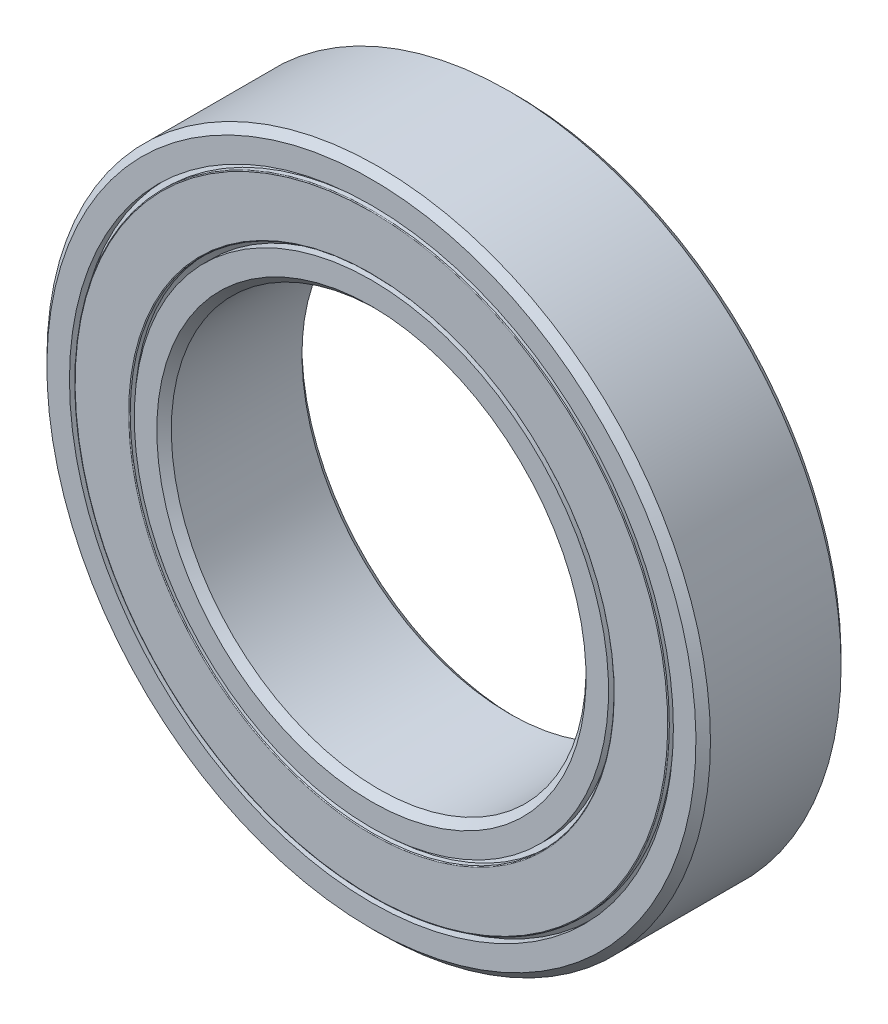
from build123d import *

# Parameters (mm, degrees)
CIRPATTERN1_COUNT   = 13
SKETCH7_R           = 13.78125
SKETCH7_R_2         = 13
BOSS_EXTRUDE1_DEPTH = 0.583333333
FILLET1_R           = 0.038888889
FILLET2_R           = 0.038888889


with BuildPart() as part:
    # Sketch3 → Revolve1 (revolve)
    with BuildSketch(Plane(origin=(0, 0, 0), x_dir=(0, 0, -1), z_dir=(1, 0, 0)), mode=Mode.PRIVATE) as revolve1_sk:
        with BuildLine():
            Line((3.15, 16), (3.5, 15.65))
            Line((3.5, 15.65), (3.5, 14.5625))
            Line((3.5, 14.5625), (1.555555556, 14.5625))
            ThreePointArc((1.555555556, 14.5625), (0, 15.204803696), (-1.555555556, 14.5625))
            Line((-1.555555556, 14.5625), (-3.5, 14.5625))
            Line((-3.5, 14.5625), (-3.5, 15.65))
            Line((-3.5, 15.65), (-3.15, 16))
            Line((-3.15, 16), (3.15, 16))
        make_face()
    revolve(revolve1_sk.sketch.rotate(Axis((0, 0, 3.5), (0, 0, -1)), 180), axis=Axis((0, 0, 3.5), (0, 0, -1)))


with BuildPart() as body_2:
    # Sketch4 → Revolve2 (revolve)
    with BuildSketch(Plane(origin=(0, 0, 0), x_dir=(0, 0, -1), z_dir=(1, 0, 0)), mode=Mode.PRIVATE) as revolve2_sk:
        with BuildLine():
            Line((-3.15, 10), (-3.5, 10.35))
            Line((-3.5, 10.35), (-3.5, 11.4375))
            Line((-3.5, 11.4375), (-1.555555556, 11.4375))
            ThreePointArc((-1.555555556, 11.4375), (0, 10.795196304), (1.555555556, 11.4375))
            Line((1.555555556, 11.4375), (3.5, 11.4375))
            Line((3.5, 11.4375), (3.5, 10.35))
            Line((3.5, 10.35), (3.15, 10))
            Line((3.15, 10), (-3.15, 10))
        make_face()
    revolve(revolve2_sk.sketch.rotate(Axis((0, 0, 3.5), (0, 0, -1)), 180), axis=Axis((0, 0, 3.5), (0, 0, -1)))


with BuildPart() as body_3:
    # Sketch5 → Revolve3 (revolve)
    with BuildSketch(Plane(origin=(0, 0, 0), x_dir=(0, 0, -1), z_dir=(1, 0, 0))):
        with BuildLine():
            Line((-2.204803696, 13), (2.204803696, 13))
            ThreePointArc((2.204803696, 13), (0, 15.204803696), (-2.204803696, 13))
        make_face()
    revolve(axis=Axis((0, 13, 2.204803696), (0, 0, -1)))


with BuildPart() as body_4:
    # Sketch6 → Revolve4 (revolve)
    with BuildSketch(Plane(origin=(0, 0, 0), x_dir=(0, 0, -1), z_dir=(1, 0, 0))):
        with BuildLine():
            Line((-2.061748717, 13.78125), (-2.301457265, 13.78125))
            ThreePointArc((-2.301457265, 13.78125), (-2.421311538, 13), (-2.301457265, 12.21875))
            Line((-2.301457265, 12.21875), (-2.061748717, 12.21875))
            ThreePointArc((-2.061748717, 12.21875), (-2.204803687, 13), (-2.061748717, 13.78125))
        make_face()
    revolve(axis=Axis((0, 16, 0), (0, -1, 0)))


with BuildPart() as cirpattern1_1:
    # CirPattern1: pattern copy
    add(body_4.part.rotate(Axis((0, 0, 0), (0, 0, 1)), 1 * 360 / CIRPATTERN1_COUNT))


with BuildPart() as cirpattern1_2:
    # CirPattern1: pattern copy
    add(body_4.part.rotate(Axis((0, 0, 0), (0, 0, 1)), 2 * 360 / CIRPATTERN1_COUNT))


with BuildPart() as cirpattern1_3:
    # CirPattern1: pattern copy
    add(body_4.part.rotate(Axis((0, 0, 0), (0, 0, 1)), 3 * 360 / CIRPATTERN1_COUNT))


with BuildPart() as cirpattern1_4:
    # CirPattern1: pattern copy
    add(body_4.part.rotate(Axis((0, 0, 0), (0, 0, 1)), 4 * 360 / CIRPATTERN1_COUNT))


with BuildPart() as cirpattern1_5:
    # CirPattern1: pattern copy
    add(body_4.part.rotate(Axis((0, 0, 0), (0, 0, 1)), 5 * 360 / CIRPATTERN1_COUNT))


with BuildPart() as cirpattern1_6:
    # CirPattern1: pattern copy
    add(body_4.part.rotate(Axis((0, 0, 0), (0, 0, 1)), 6 * 360 / CIRPATTERN1_COUNT))


with BuildPart() as cirpattern1_7:
    # CirPattern1: pattern copy
    add(body_4.part.rotate(Axis((0, 0, 0), (0, 0, 1)), 7 * 360 / CIRPATTERN1_COUNT))


with BuildPart() as cirpattern1_8:
    # CirPattern1: pattern copy
    add(body_4.part.rotate(Axis((0, 0, 0), (0, 0, 1)), 8 * 360 / CIRPATTERN1_COUNT))


with BuildPart() as cirpattern1_9:
    # CirPattern1: pattern copy
    add(body_4.part.rotate(Axis((0, 0, 0), (0, 0, 1)), 9 * 360 / CIRPATTERN1_COUNT))


with BuildPart() as cirpattern1_10:
    # CirPattern1: pattern copy
    add(body_4.part.rotate(Axis((0, 0, 0), (0, 0, 1)), 10 * 360 / CIRPATTERN1_COUNT))


with BuildPart() as cirpattern1_11:
    # CirPattern1: pattern copy
    add(body_4.part.rotate(Axis((0, 0, 0), (0, 0, 1)), 11 * 360 / CIRPATTERN1_COUNT))


with BuildPart() as cirpattern1_12:
    # CirPattern1: pattern copy
    add(body_4.part.rotate(Axis((0, 0, 0), (0, 0, 1)), 12 * 360 / CIRPATTERN1_COUNT))


with BuildPart() as cirpattern1_13:
    # CirPattern1: pattern copy
    add(body_3.part.rotate(Axis((0, 0, 0), (0, 0, 1)), 1 * 360 / CIRPATTERN1_COUNT))


with BuildPart() as cirpattern1_14:
    # CirPattern1: pattern copy
    add(body_3.part.rotate(Axis((0, 0, 0), (0, 0, 1)), 2 * 360 / CIRPATTERN1_COUNT))


with BuildPart() as cirpattern1_15:
    # CirPattern1: pattern copy
    add(body_3.part.rotate(Axis((0, 0, 0), (0, 0, 1)), 3 * 360 / CIRPATTERN1_COUNT))


with BuildPart() as cirpattern1_16:
    # CirPattern1: pattern copy
    add(body_3.part.rotate(Axis((0, 0, 0), (0, 0, 1)), 4 * 360 / CIRPATTERN1_COUNT))


with BuildPart() as cirpattern1_17:
    # CirPattern1: pattern copy
    add(body_3.part.rotate(Axis((0, 0, 0), (0, 0, 1)), 5 * 360 / CIRPATTERN1_COUNT))


with BuildPart() as cirpattern1_18:
    # CirPattern1: pattern copy
    add(body_3.part.rotate(Axis((0, 0, 0), (0, 0, 1)), 6 * 360 / CIRPATTERN1_COUNT))


with BuildPart() as cirpattern1_19:
    # CirPattern1: pattern copy
    add(body_3.part.rotate(Axis((0, 0, 0), (0, 0, 1)), 7 * 360 / CIRPATTERN1_COUNT))


with BuildPart() as cirpattern1_20:
    # CirPattern1: pattern copy
    add(body_3.part.rotate(Axis((0, 0, 0), (0, 0, 1)), 8 * 360 / CIRPATTERN1_COUNT))


with BuildPart() as cirpattern1_21:
    # CirPattern1: pattern copy
    add(body_3.part.rotate(Axis((0, 0, 0), (0, 0, 1)), 9 * 360 / CIRPATTERN1_COUNT))


with BuildPart() as cirpattern1_22:
    # CirPattern1: pattern copy
    add(body_3.part.rotate(Axis((0, 0, 0), (0, 0, 1)), 10 * 360 / CIRPATTERN1_COUNT))


with BuildPart() as cirpattern1_23:
    # CirPattern1: pattern copy
    add(body_3.part.rotate(Axis((0, 0, 0), (0, 0, 1)), 11 * 360 / CIRPATTERN1_COUNT))


with BuildPart() as cirpattern1_24:
    # CirPattern1: pattern copy
    add(body_3.part.rotate(Axis((0, 0, 0), (0, 0, 1)), 12 * 360 / CIRPATTERN1_COUNT))


with BuildPart() as body_29:
    # Sketch7 → Boss-Extrude1 (new, symmetric)
    with BuildSketch(Plane.XY):
        Circle(SKETCH7_R)
        Circle(SKETCH7_R_2, mode=Mode.SUBTRACT)
    extrude(amount=BOSS_EXTRUDE1_DEPTH, both=True)


with BuildPart() as body_30:
    # Sketch8 → Revolve5 (revolve)
    with BuildSketch(Plane(origin=(0, 0, 0), x_dir=(0, 0, -1), z_dir=(1, 0, 0)), mode=Mode.PRIVATE) as revolve5_sk:
        Polygon((-3.5, 14.328125), (-3.240740741, 14.328125), (-3.111111111, 14.5625), (-3.111111111, 14.328125), (-3.111111111, 11.671875), (-3.111111111, 11.4375), (-3.240740741, 11.671875), (-3.5, 11.671875), align=None)
        Polygon((3.5, 14.328125), (3.5, 11.671875), (3.240740741, 11.671875), (3.111111111, 11.4375), (3.111111111, 11.671875), (3.111111111, 14.328125), (3.111111111, 14.5625), (3.240740741, 14.328125), align=None)
    revolve(revolve5_sk.sketch.rotate(Axis((0, 0, 3.5), (0, 0, -1)), 180), axis=Axis((0, 0, 3.5), (0, 0, -1)))

    # Fillet1
    fillet1_edges = [body_30.edges().sort_by_distance(p)[0] for p in [
        (0, 14.328125, 3.5),
        (0, 11.671875, 3.5),
    ]]
    fillet(fillet1_edges, radius=FILLET1_R)

    # Fillet2
    fillet2_edges = [body_30.edges().sort_by_distance(p)[0] for p in [
        (0, 14.328125, -3.5),
        (0, 11.671875, -3.5),
    ]]
    fillet(fillet2_edges, radius=FILLET2_R)


solid = Compound([part.part, body_2.part, body_3.part, body_4.part, cirpattern1_1.part, cirpattern1_2.part, cirpattern1_3.part, cirpattern1_4.part, cirpattern1_5.part, cirpattern1_6.part, cirpattern1_7.part, cirpattern1_8.part, cirpattern1_9.part, cirpattern1_10.part, cirpattern1_11.part, cirpattern1_12.part, cirpattern1_13.part, cirpattern1_14.part, cirpattern1_15.part, cirpattern1_16.part, cirpattern1_17.part, cirpattern1_18.part, cirpattern1_19.part, cirpattern1_20.part, cirpattern1_21.part, cirpattern1_22.part, cirpattern1_23.part, cirpattern1_24.part, body_29.part, body_30.part])
